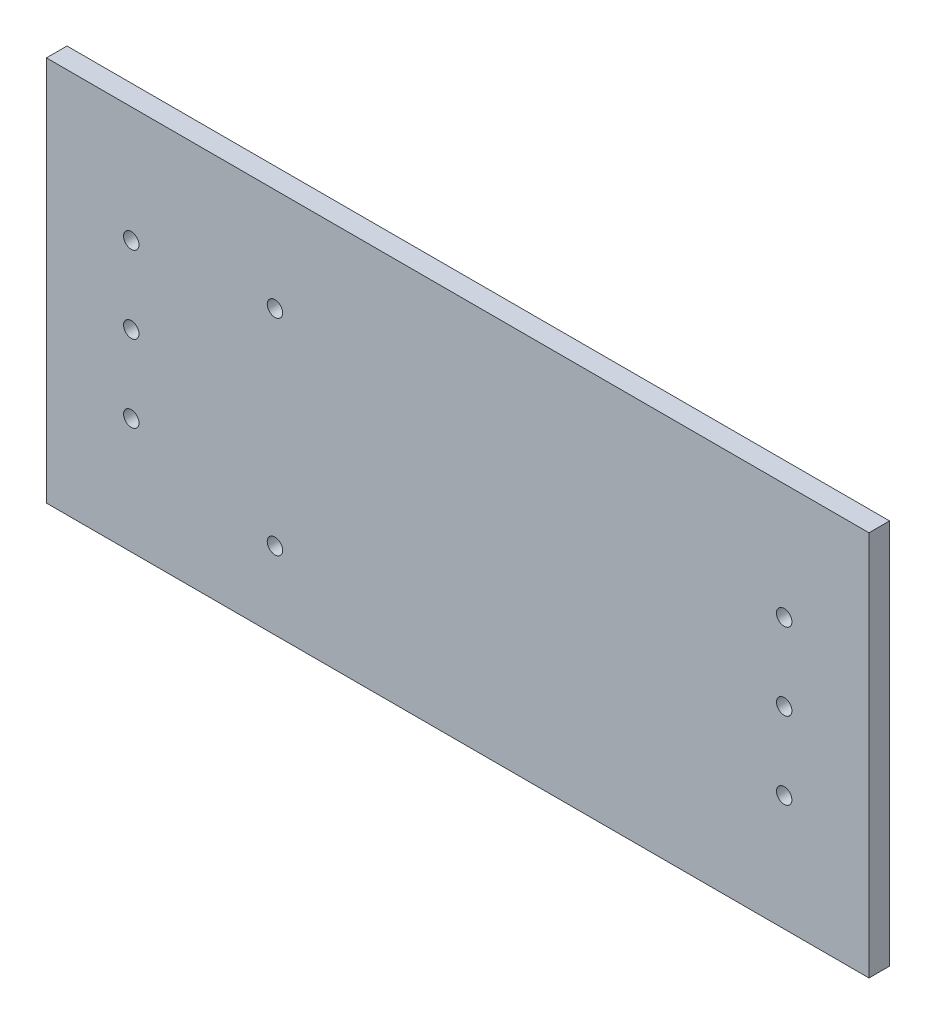
from build123d import *

# Parameters (mm, degrees)
SKETCH1_W                       = 160
SKETCH1_H                       = 75
BOSS_EXTRUDE1_DEPTH             = 4
F_3_0MM_DOWEL_HOLE1_D           = 3
F_3_0MM_DOWEL_HOLE2_D           = 3
F_3_0MM_PRESS_DOWEL_HOLE1_D     = 3
F_3_0MM_PRESS_DOWEL_HOLE1_DEPTH = 6
F_3_0MM_PRESS_DOWEL_HOLE1_TIP   = 0.901290929


with BuildPart() as part:
    # Sketch1 → Boss-Extrude1 (new body)
    with BuildSketch(Plane.XY):
        with Locations((80, 37.5)):
            Rectangle(SKETCH1_W, SKETCH1_H)
    extrude(amount=BOSS_EXTRUDE1_DEPTH)

    # Ø3.0mm Dowel Hole1 (through all)
    with Locations(Plane.XY.offset(4)):
        with Locations((16.5, 52.5), (16.5, 22.5), (143.5, 52.5), (143.5, 22.5)):
            Hole(F_3_0MM_DOWEL_HOLE1_D / 2)

    # Ø3.0mm Dowel Hole2 (through all)
    with Locations(Plane.XY.offset(4)):
        with Locations((16.5, 37.5), (143.5, 37.5)):
            Hole(F_3_0MM_DOWEL_HOLE2_D / 2)

    # Ø3.0mm Press Dowel Hole1
    with Locations(Plane.XY.offset(4)):
        with Locations((44.446877451, 15), (44.446877451, 55)):
            Hole(F_3_0MM_PRESS_DOWEL_HOLE1_D / 2, depth=F_3_0MM_PRESS_DOWEL_HOLE1_DEPTH)
            with Locations((0, 0, -(F_3_0MM_PRESS_DOWEL_HOLE1_DEPTH + F_3_0MM_PRESS_DOWEL_HOLE1_TIP / 2))):  # 118° drill point
                Cone(0, F_3_0MM_PRESS_DOWEL_HOLE1_D / 2, F_3_0MM_PRESS_DOWEL_HOLE1_TIP, mode=Mode.SUBTRACT)


solid = part.part
